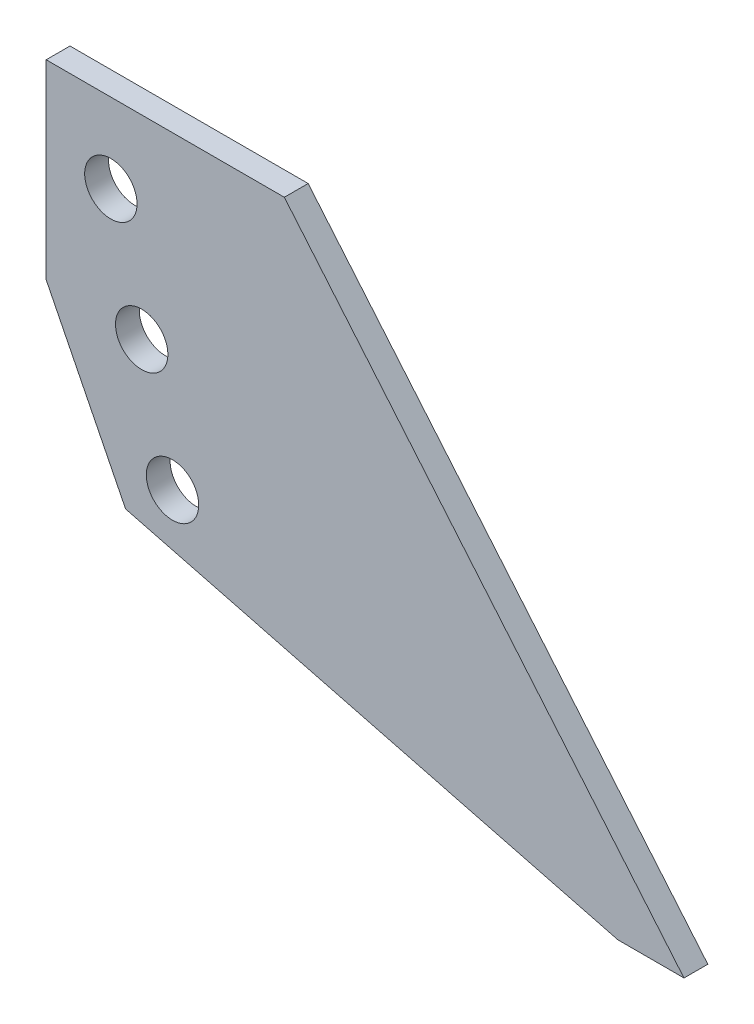
from build123d import *

# Parameters (mm, degrees)
RESSALTO_EXTRUS_O1_DEPTH = 3
FURO_COM_FOLGA_DE_M61_D  = 6.6
CORTE_EXTRUS_O1_DEPTH    = 101.321862822


with BuildPart() as part:
    # Esboço1 → Ressalto-extrusão1 (new body)
    with BuildSketch(Plane.XY):
        Polygon((0, 0), (0, 60), (30, 60), (80.345977871, 0), align=None)
    extrude(amount=RESSALTO_EXTRUS_O1_DEPTH)

    # Furo com folga de M61 (through all)
    with Locations(Plane.XY.offset(3)):
        with Locations((15.913142528, 21.022225211), (12.030856852, 35.511112606), (8.148571175, 50)):
            Hole(FURO_COM_FOLGA_DE_M61_D / 2)

    # Esboço4 → Corte-extrusão1 (cut, through all)
    with BuildSketch(Plane.XY.offset(3)):
        Polygon((0, 36), (10, 16), (72, 0), (0, 0), align=None)
    extrude(amount=-CORTE_EXTRUS_O1_DEPTH, mode=Mode.SUBTRACT)


solid = part.part
